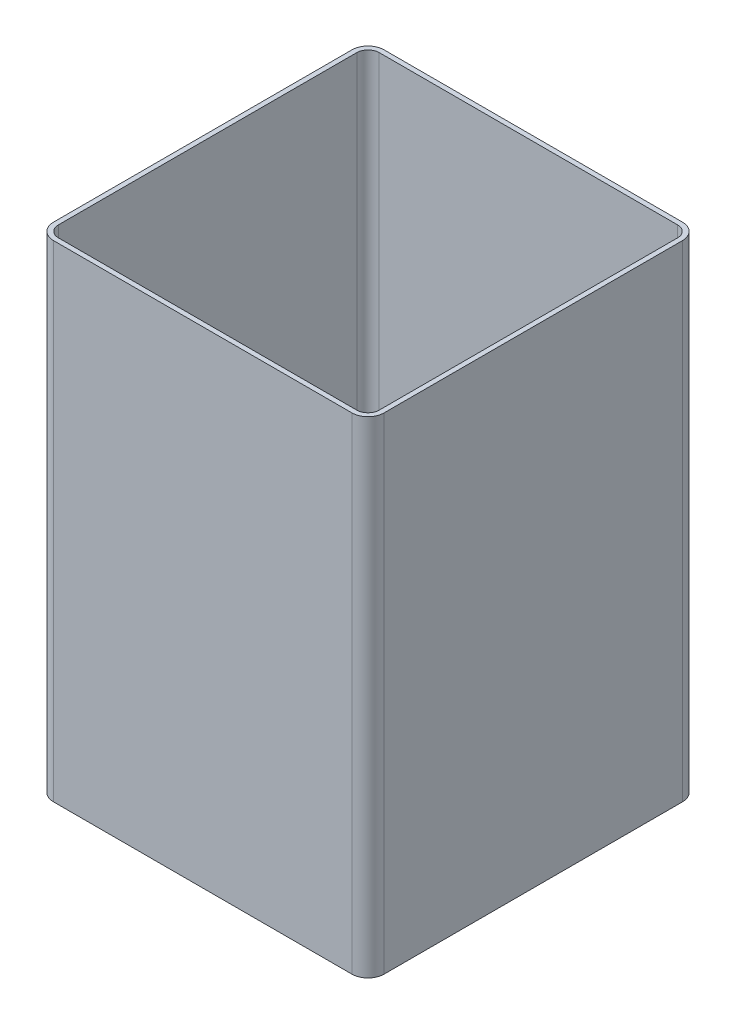
from build123d import *

# Parameters (mm, degrees)
SKETCH1_W           = 206
SKETCH1_H           = 206
BOSS_EXTRUDE1_DEPTH = 303
FILLET1_R           = 10
SHELL1_T            = -3


with BuildPart() as part:
    # Sketch1 → Boss-Extrude1 (new body)
    with BuildSketch(Plane(origin=(0, 0, 0), x_dir=(1, 0, 0), z_dir=(0, 1, 0))):
        Rectangle(SKETCH1_W, SKETCH1_H)
    extrude(amount=BOSS_EXTRUDE1_DEPTH)

    # Fillet1
    fillet1_edges = [part.edges().sort_by_distance(p)[0] for p in [
        (103, 151.5, 103),
        (-103, 151.5, 103),
        (-103, 151.5, -103),
        (103, 151.5, -103),
    ]]
    fillet(fillet1_edges, radius=FILLET1_R)

    # Shell1
    shell1_openings = [part.faces().sort_by_distance(p)[0] for p in [
        (0, 303, 0),
    ]]
    offset(amount=SHELL1_T, openings=shell1_openings, kind=Kind.INTERSECTION)


solid = part.part
